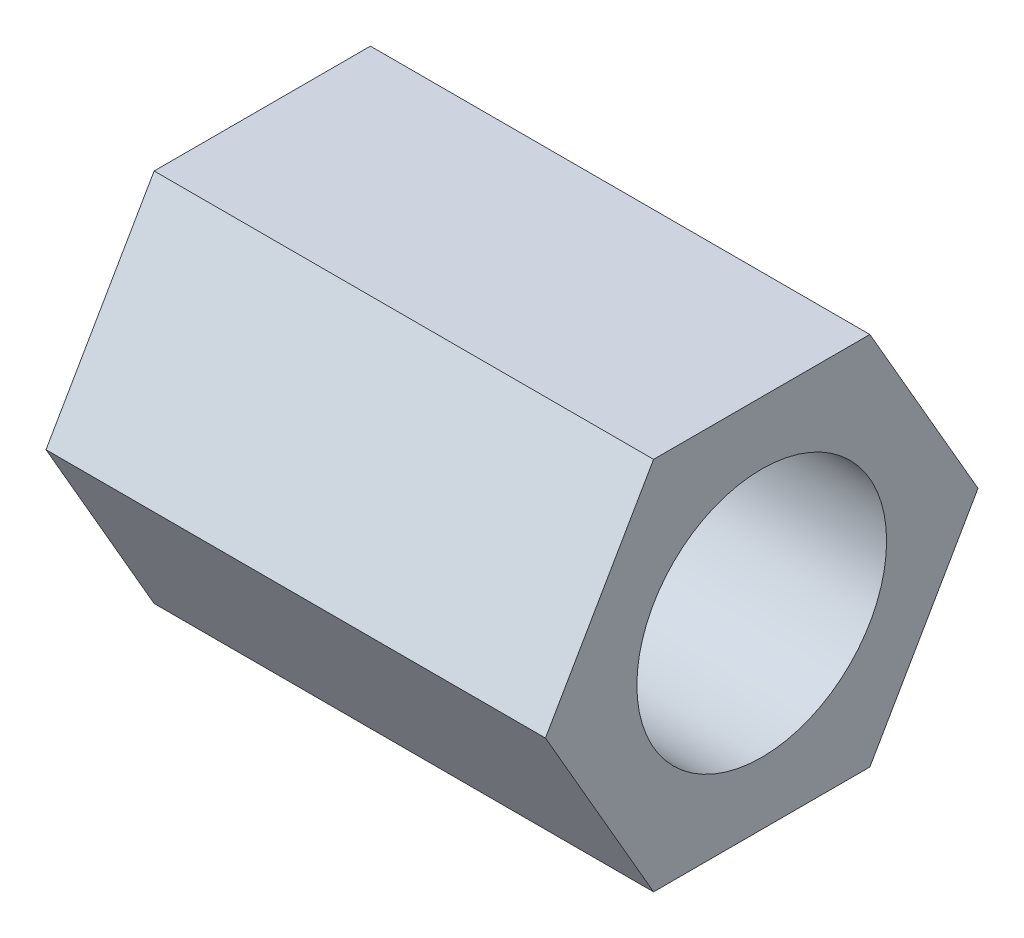
from build123d import *

# Parameters (mm, degrees)
SKETCH_1_R          = 1.5
EXTRUDE_1_DEPTH     = 6
EXTRUDE_2_DEPTH     = 6
CUT_EXTRUDE_START   = -7
SKETCH_4_R          = 1.5
CUT_EXTRUDE_1_DEPTH = 7
SKETCH_5_R          = 2.902740869
CUT_EXTRUDE_2_DEPTH = 6


with BuildPart() as part:
    # 草图1 → 凸台-拉伸1 (new body)
    with BuildSketch(Plane(origin=(0, 0, 0), x_dir=(0, 0, -1), z_dir=(1, 0, 0))):
        Circle(SKETCH_1_R)
    extrude(amount=EXTRUDE_1_DEPTH)

    # 草图2 → 凸台-拉伸2 (add)
    with BuildSketch(Plane(origin=(6, 0, 0), x_dir=(0, 0, -1), z_dir=(1, 0, 0))):
        Polygon((2.598076211, 0), (1.299038106, 2.25), (-1.299038106, 2.25), (-2.598076211, 0), (-1.299038106, -2.25), (1.299038106, -2.25), align=None)
    extrude(amount=EXTRUDE_2_DEPTH)

    # 草图4 → 切除-拉伸1 (cut)
    with BuildSketch(Plane(origin=(12, 0, 0), x_dir=(0, 0, -1), z_dir=(1, 0, 0)).offset(CUT_EXTRUDE_START)):
        Circle(SKETCH_4_R)
    extrude(amount=CUT_EXTRUDE_1_DEPTH, mode=Mode.SUBTRACT)


with BuildPart() as cut_extrude_1_piece_1:
    # of the separate pieces the step leaves, piece 1, a body of its own (cut_extrude_1_pieces)
    add(part.part.solids().sort_by_distance((6, 0, -2.598076211))[0])


with BuildPart() as cut_extrude_1_piece_2:
    # of the separate pieces the step leaves, piece 2, a body of its own (cut_extrude_1_pieces)
    add(part.part.solids().sort_by_distance((0, 0, -1.5))[0])

    # 草图5 → 切除-拉伸2 (cut)
    with BuildSketch(Plane.ZY):
        Circle(SKETCH_5_R)
    extrude(amount=-CUT_EXTRUDE_2_DEPTH, mode=Mode.SUBTRACT)


solid = cut_extrude_1_piece_1.part
